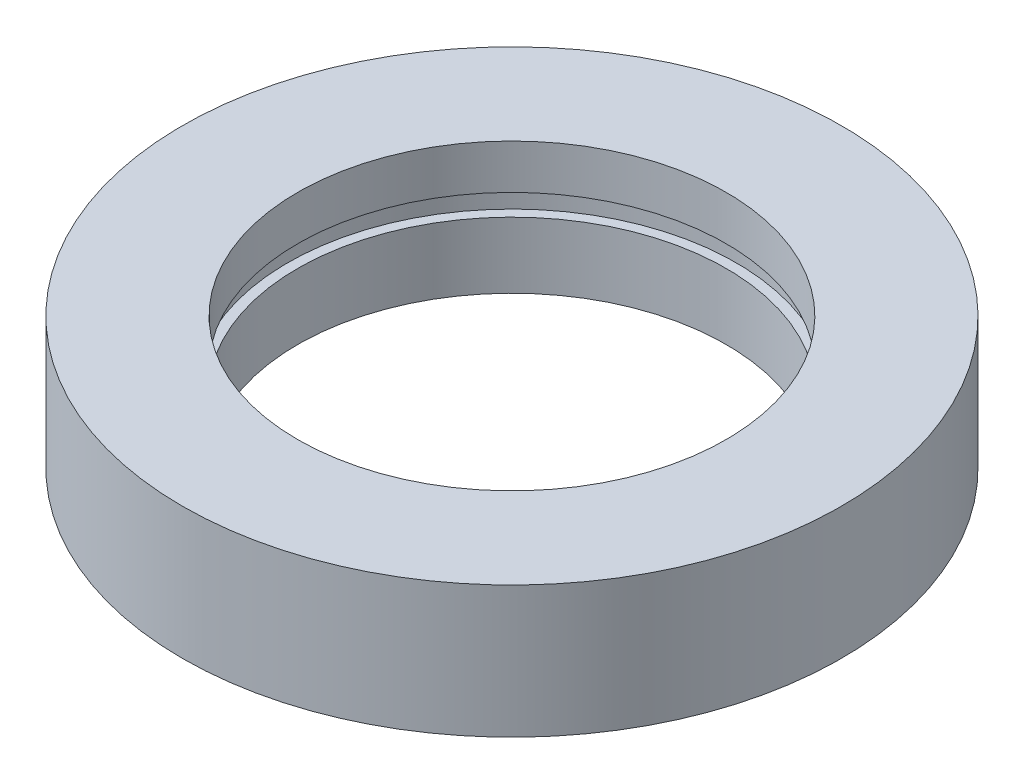
from build123d import *

# Parameters (mm, degrees)
SKETCH1_R           = 20
SKETCH1_R_2         = 13
BOSS_EXTRUDE1_DEPTH = 8
SKETCH2_W           = 0.6
SKETCH2_H           = 1.3


with BuildPart() as part:
    # Sketch1 → Boss-Extrude1 (new body)
    with BuildSketch(Plane(origin=(0, 0, 0), x_dir=(1, 0, 0), z_dir=(0, 1, 0))):
        with Locations(Location((0, 0, 0), (0, 0, 270))):
            Circle(SKETCH1_R)
        with Locations(Location((0, 0, 0), (0, 0, 270))):
            Circle(SKETCH1_R_2, mode=Mode.SUBTRACT)
    extrude(amount=BOSS_EXTRUDE1_DEPTH)

    # Sketch2 → Cut-Revolve1 (revolve, cut)
    with BuildSketch(Plane(origin=(0, 0, 0), x_dir=(0, 0, -1), z_dir=(1, 0, 0)), mode=Mode.PRIVATE) as cut_revolve1_sk:
        with Locations((13.3, 4.65)):
            Rectangle(SKETCH2_W, SKETCH2_H)
    revolve(cut_revolve1_sk.sketch.rotate(Axis((0, 8, 0), (0, -1, 0)), 180), axis=Axis((0, 8, 0), (0, -1, 0)), mode=Mode.SUBTRACT)


solid = part.part
